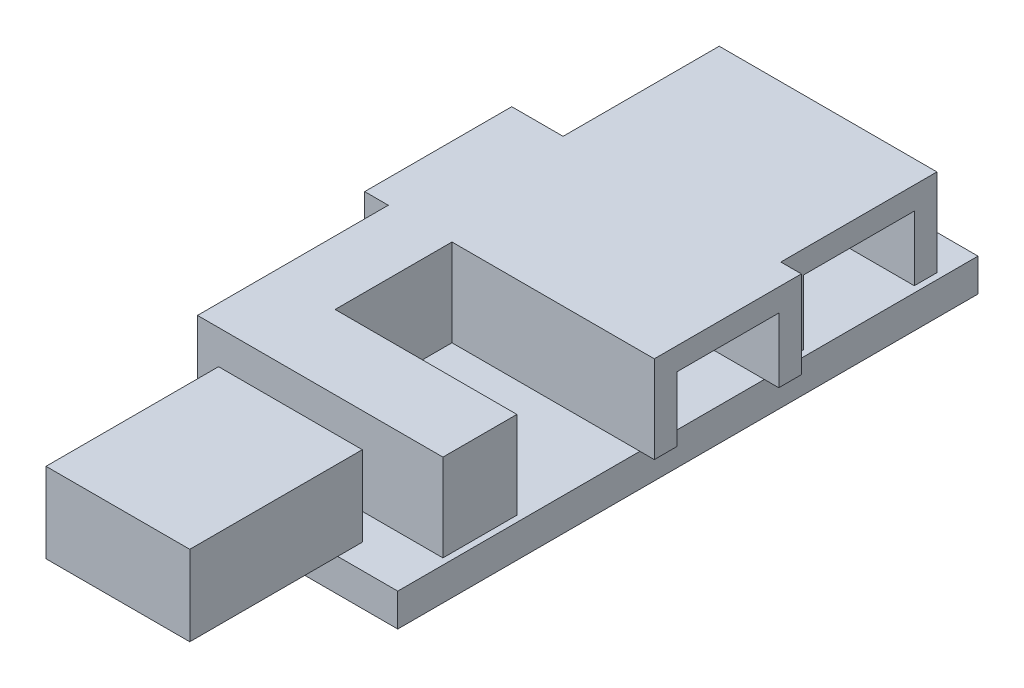
from build123d import *

# Parameters (mm, degrees)
SKETCH1_W               = 32.639
SKETCH1_H               = 71.755
BOSS_EXTRUDE1_DEPTH     = 4.064
BOSS_EXTRUDE2_DEPTH     = 10.795
SKETCH3_W               = 17.78
SKETCH3_H               = 21.336
BOSS_EXTRUDE3_DEPTH     = 9.906
CUT_EXTRUDE1_DEPTH      = 66.282848799
CUT_EXTRUDE1_DEPTH_BACK = 66.282848799
SKETCH4_W               = 13.716
SKETCH4_H               = 8.001
SKETCH4_W_2             = 12.5984


with BuildPart() as part:
    # Sketch1 → Boss-Extrude1 (new body)
    with BuildSketch(Plane(origin=(0, 0, 0), x_dir=(1, 0, 0), z_dir=(0, 1, 0))):
        Rectangle(SKETCH1_W, SKETCH1_H)
    extrude(amount=BOSS_EXTRUDE1_DEPTH)

    # Sketch2 → Boss-Extrude2 (add)
    with BuildSketch(Plane(origin=(0, 4.064, 0), x_dir=(1, 0, 0), z_dir=(0, 1, 0))):
        Polygon((15.5575, 31.5595), (-11.3665, 31.5595), (-11.3665, 12.2555), (-17.7165, 12.2555), (-17.7165, -5.9309), (-14.7955, -5.9309), (-14.7955, -29.5275), (15.5575, -29.5275), (15.5575, -20.3835), (-6.9215, -20.3835), (-6.9215, -5.9309), (18.0975, -5.9309), (18.0975, 12.2555), (15.5575, 12.2555), align=None)
    extrude(amount=BOSS_EXTRUDE2_DEPTH)

    # Sketch3 → Boss-Extrude3 (add)
    with BuildSketch(Plane(origin=(0, 4.064, 0), x_dir=(1, 0, 0), z_dir=(0, 1, 0))):
        with Locations((0, -43.4975)):
            Rectangle(SKETCH3_W, SKETCH3_H)
    extrude(amount=BOSS_EXTRUDE3_DEPTH)

    # Sketch4 → Cut-Extrude1 (cut, two sides: drawn at the far end of the back side and taken through both)
    with BuildSketch(Plane(origin=(15.5575, 0, 0), x_dir=(0, 0, -1), z_dir=(1, 0, 0)).offset(-CUT_EXTRUDE1_DEPTH_BACK)):
        with Locations((21.9075, 8.0645)):
            Rectangle(SKETCH4_W, SKETCH4_H)
        with Locations((3.1623, 8.0645)):
            Rectangle(SKETCH4_W_2, SKETCH4_H)
    extrude(amount=CUT_EXTRUDE1_DEPTH + CUT_EXTRUDE1_DEPTH_BACK, mode=Mode.SUBTRACT)


solid = part.part
